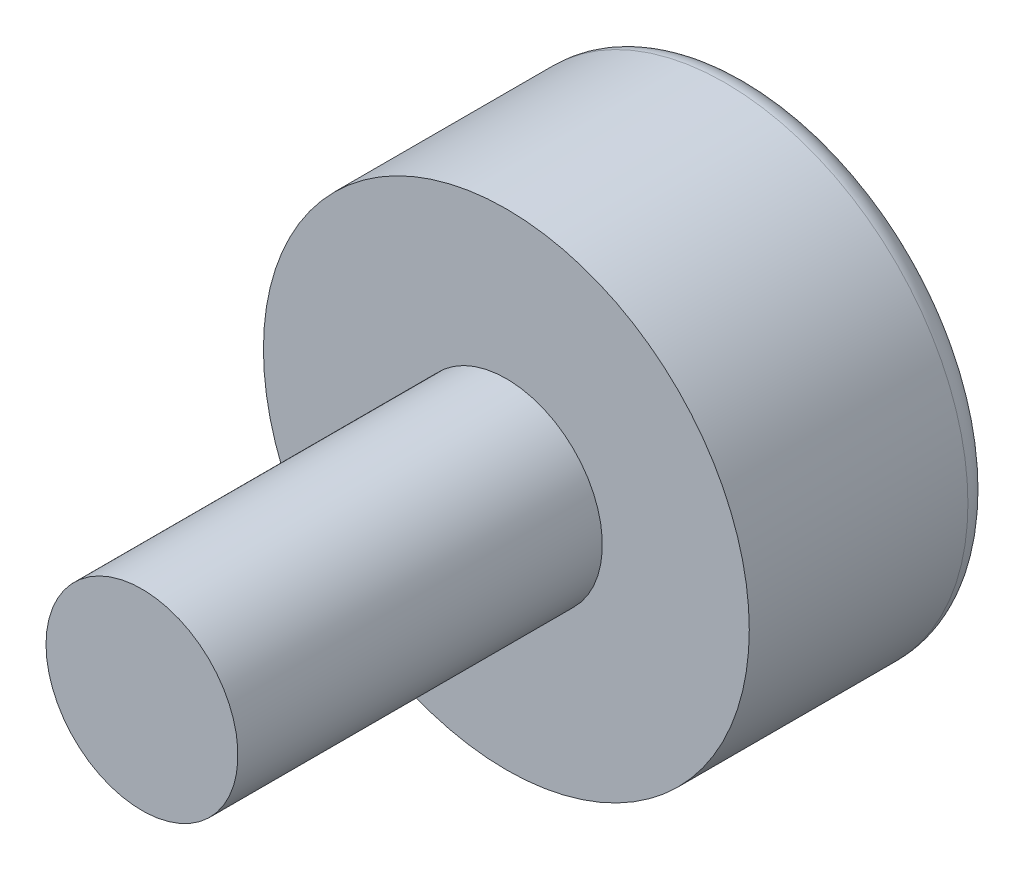
from build123d import *

# Parameters (mm, degrees)
SKETCH1_R           = 2.54
BOSS_EXTRUDE1_DEPTH = 2.54
SKETCH2_R           = 1.0033
BOSS_EXTRUDE2_DEPTH = 3.81
FILLET1_R           = 0.254


with BuildPart() as part:
    # Sketch1 → Boss-Extrude1 (new body)
    with BuildSketch(Plane.XY):
        Circle(SKETCH1_R)
    extrude(amount=BOSS_EXTRUDE1_DEPTH)

    # Sketch2 → Boss-Extrude2 (add)
    with BuildSketch(Plane.XY.offset(2.54)):
        with Locations(Location((0, 0, 0), (0, 0, 180))):
            Circle(SKETCH2_R)
    extrude(amount=BOSS_EXTRUDE2_DEPTH)

    # Fillet1
    fillet1_edges = [part.edges().sort_by_distance(p)[0] for p in [
        (-2.54, 0, 0),
    ]]
    fillet(fillet1_edges, radius=FILLET1_R)


solid = part.part
